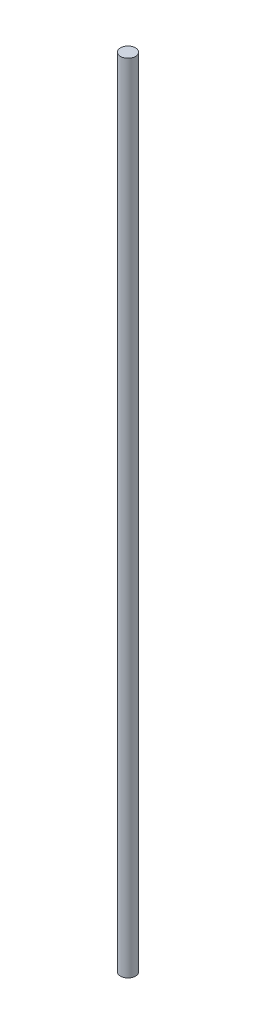
from build123d import *

# Parameters (mm, degrees)
SKETCH_1_R      = 1.6
EXTRUDE_1_DEPTH = 170


with BuildPart() as part:
    # 草图1 → 凸台-拉伸1 (new body)
    with BuildSketch(Plane(origin=(0, 0, 0), x_dir=(1, 0, 0), z_dir=(0, 1, 0))):
        with Locations(Location((0, 0, 0), (0, 0, 270))):
            Circle(SKETCH_1_R)
    extrude(amount=EXTRUDE_1_DEPTH)


solid = part.part
